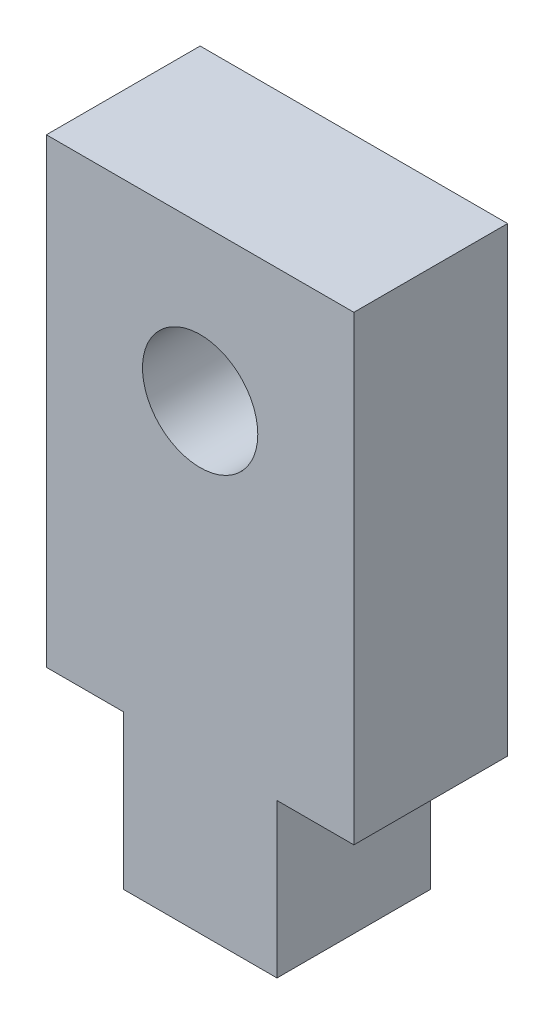
from build123d import *

# Parameters (mm, degrees)
SKETCH1_R           = 1.875
BOSS_EXTRUDE1_DEPTH = 5


with BuildPart() as part:
    # Sketch1 → Boss-Extrude1 (new body)
    with BuildSketch(Plane.XY):
        Polygon((2.5, -7.5), (5, -7.5), (5, 7.5), (-5, 7.5), (-5, -7.5), (-2.5, -7.5), (-2.5, -12.5), (2.5, -12.5), align=None)
        with Locations((0, 2.5)):
            Circle(SKETCH1_R, mode=Mode.SUBTRACT)
    extrude(amount=BOSS_EXTRUDE1_DEPTH)


solid = part.part
